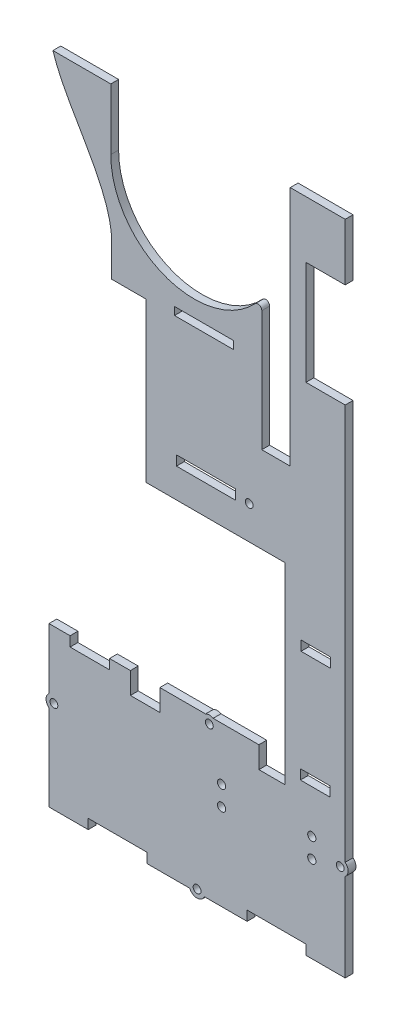
from build123d import *

# Parameters (mm, degrees)
SKETCH1_W           = 151
SKETCH1_H           = 254
BOSS_EXTRUDE1_DEPTH = 4
SKETCH2_W           = 49.486524855
SKETCH2_H           = 99.222786378
CUT_EXTRUDE1_DEPTH  = 5
SKETCH4_W           = 120.35
SKETCH4_H           = 88.04721362
CUT_EXTRUDE3_DEPTH  = 5
SKETCH6_R           = 2
CUT_EXTRUDE5_DEPTH  = 10
SKETCH12_W          = 15
SKETCH12_H          = 10
SKETCH12_W_2        = 13.35
CUT_EXTRUDE8_DEPTH  = 10
SKETCH13_R          = 2
CUT_EXTRUDE9_DEPTH  = 5
SKETCH14_R          = 4
SKETCH14_R_2        = 2
BOSS_EXTRUDE2_DEPTH = 4
SKETCH15_R          = 2.1
CUT_EXTRUDE10_DEPTH = 10
SKETCH18_R          = 2
CUT_EXTRUDE12_DEPTH = 5
SKETCH19_R          = 4
SKETCH19_R_2        = 2
BOSS_EXTRUDE3_DEPTH = 4
SKETCH25_W          = 59.513475145
SKETCH25_H          = 4
CUT_EXTRUDE16_DEPTH = 10
SKETCH26_W          = 151
SKETCH26_H          = 86
BOSS_EXTRUDE4_DEPTH = 4
SKETCH27_W          = 42
SKETCH27_H          = 62
BOSS_EXTRUDE5_DEPTH = 4
CUT_EXTRUDE17_DEPTH = 5
SKETCH29_W          = 20
SKETCH29_H          = 53
CUT_EXTRUDE18_DEPTH = 10
SKETCH30_W          = 14.513475145
SKETCH30_H          = 123
CUT_EXTRUDE19_DEPTH = 10
CUT_EXTRUDE20_DEPTH = 10
FILLET1_R           = 2
SKETCH33_W          = 30
SKETCH33_H          = 4
CUT_EXTRUDE22_DEPTH = 10
SKETCH34_W          = 30
SKETCH34_H          = 5
SKETCH34_W_2        = 15
CUT_EXTRUDE23_DEPTH = 10
SKETCH35_W          = 50.5
SKETCH35_H          = 0.999999998
SKETCH35_W_2        = 41.5
BOSS_EXTRUDE6_DEPTH = 4
SKETCH36_W          = 20.104648663
SKETCH36_H          = 5
CUT_EXTRUDE24_DEPTH = 5
SKETCH37_R          = 2
CUT_EXTRUDE25_DEPTH = 5
SKETCH38_R          = 4
SKETCH38_R_2        = 2
BOSS_EXTRUDE7_DEPTH = 4
SKETCH39_R          = 2
CUT_EXTRUDE26_DEPTH = 10


with BuildPart() as part:
    # Sketch1 → Boss-Extrude1 (new body)
    with BuildSketch(Plane.XY):
        with Locations((0, 0.5)):
            Rectangle(SKETCH1_W, SKETCH1_H)
    extrude(amount=BOSS_EXTRUDE1_DEPTH)

    # Sketch2 → Cut-Extrude1 (cut)
    with BuildSketch(Plane.XY.offset(4)):
        with Locations((-50.756737573, 77.888606811)):
            Rectangle(SKETCH2_W, SKETCH2_H)
    extrude(amount=-CUT_EXTRUDE1_DEPTH, mode=Mode.SUBTRACT)

    # Sketch4 → Cut-Extrude3 (cut)
    with BuildSketch(Plane.XY.offset(4)):
        with Locations((-15.325, -2.476393188)):
            Rectangle(SKETCH4_W, SKETCH4_H)
    extrude(amount=-CUT_EXTRUDE3_DEPTH, mode=Mode.SUBTRACT)

    # Sketch6 → Cut-Extrude5 (cut)
    with BuildSketch(Plane.XY.offset(4)):
        with Locations((0, -125)):
            Circle(SKETCH6_R)
    extrude(amount=-CUT_EXTRUDE5_DEPTH, mode=Mode.SUBTRACT)

    # Sketch12 → Cut-Extrude8 (cut)
    with BuildSketch(Plane.XY.offset(4)):
        with Locations((-26.5, -51.499999998)):
            Rectangle(SKETCH12_W, SKETCH12_H)
        with Locations((38.175, -51.499999998)):
            Rectangle(SKETCH12_W_2, SKETCH12_H)
    extrude(amount=-CUT_EXTRUDE8_DEPTH, mode=Mode.SUBTRACT)

    # Sketch13 → Cut-Extrude9 (cut)
    with BuildSketch(Plane.XY.offset(4)):
        with Locations((6.25, -49)):
            Circle(SKETCH13_R)
    extrude(amount=-CUT_EXTRUDE9_DEPTH, mode=Mode.SUBTRACT)

    # Sketch14 → Boss-Extrude2 (add)
    # profile 1 of 2: a face of its own
    with BuildSketch(Plane.XY.offset(4)):
        with Locations((6.25, -49)):
            Circle(SKETCH14_R)
        with Locations((6.25, -49)):
            Circle(SKETCH14_R_2, mode=Mode.SUBTRACT)
    # profile 2 of 2: a face of its own
    with BuildSketch(Plane.XY.offset(4)):
        with Locations((0, -125)):
            Circle(SKETCH14_R)
        with Locations((0, -125)):
            Circle(SKETCH14_R_2, mode=Mode.SUBTRACT)
    extrude(amount=-BOSS_EXTRUDE2_DEPTH)

    # Sketch15 → Cut-Extrude10 (cut)
    with BuildSketch(Plane(origin=(0, 0, 0), x_dir=(-1, 0, 0), z_dir=(0, 0, -1))):
        with Locations((-58.5, -72.5)):
            Circle(SKETCH15_R)
        with Locations((-58.5, -82.5)):
            Circle(SKETCH15_R)
        with Locations((-12.5, -72.5)):
            Circle(SKETCH15_R)
        with Locations((-12.5, -82.5)):
            Circle(SKETCH15_R)
    extrude(amount=-CUT_EXTRUDE10_DEPTH, mode=Mode.SUBTRACT)

    # Sketch18 → Cut-Extrude12 (cut)
    with BuildSketch(Plane.XY.offset(4)):
        with Locations((-73, -79.562158061)):
            Circle(SKETCH18_R)
    extrude(amount=-CUT_EXTRUDE12_DEPTH, mode=Mode.SUBTRACT)

    # Sketch19 → Boss-Extrude3 (add)
    with BuildSketch(Plane.XY.offset(4)):
        with Locations((-73, -79.562158061)):
            Circle(SKETCH19_R)
        with Locations((-73, -79.562158061)):
            Circle(SKETCH19_R_2, mode=Mode.SUBTRACT)
    extrude(amount=-BOSS_EXTRUDE3_DEPTH)

    # Sketch25 → Cut-Extrude16 (cut)
    with BuildSketch(Plane.XY.offset(4)):
        with Locations((3.743262427, 124.5)):
            Rectangle(SKETCH25_W, SKETCH25_H)
    extrude(amount=-CUT_EXTRUDE16_DEPTH, mode=Mode.SUBTRACT)

    # Sketch26 → Boss-Extrude4 (add)
    with BuildSketch(Plane.XY.offset(4)):
        with Locations((0, 165.5)):
            Rectangle(SKETCH26_W, SKETCH26_H)
    extrude(amount=-BOSS_EXTRUDE4_DEPTH)

    # Sketch27 → Boss-Extrude5 (add)
    with BuildSketch(Plane.XY.offset(4)):
        with Locations((54.5, 91.5)):
            Rectangle(SKETCH27_W, SKETCH27_H)
    extrude(amount=-BOSS_EXTRUDE5_DEPTH)

    # Sketch28 → Cut-Extrude17 (cut)
    with BuildSketch(Plane(origin=(0, 0, 0), x_dir=(-1, 0, 0), z_dir=(0, 0, -1))):
        with BuildLine():
            Line((43.55584756, 136.203397333), (43.55584756, 122.5))
            Line((43.55584756, 122.5), (75.5, 122.5))
            Line((75.5, 122.5), (75.5, 208.5))
            Line((75.5, 208.5), (73.5, 208.5))
            add(Edge.make_bspline(
                [(73.5, 208.5), (66.265840294, 185.251616354), (42.071208011, 161.186737721), (43.55584756, 136.203397333)],
                knots=[0, 0, 0, 0, 0.885856011, 0.885856011, 0.885856011, 0.885856011], degree=3))
        make_face()
    extrude(amount=-CUT_EXTRUDE17_DEPTH, mode=Mode.SUBTRACT)

    # Sketch29 → Cut-Extrude18 (cut)
    with BuildSketch(Plane(origin=(0, 0, 0), x_dir=(-1, 0, 0), z_dir=(0, 0, -1))):
        with Locations((-65.5, 153)):
            Rectangle(SKETCH29_W, SKETCH29_H)
    extrude(amount=-CUT_EXTRUDE18_DEPTH, mode=Mode.SUBTRACT)

    # Sketch30 → Cut-Extrude19 (cut)
    with BuildSketch(Plane.XY.offset(4)):
        with Locations((40.243262427, 147)):
            Rectangle(SKETCH30_W, SKETCH30_H)
    extrude(amount=-CUT_EXTRUDE19_DEPTH, mode=Mode.SUBTRACT)

    # Sketch31 → Cut-Extrude20 (cut)
    with BuildSketch(Plane.XY.offset(4)):
        with BuildLine():
            Line((-44, 177.3), (-44, 208.5))
            Line((-44, 208.5), (41, 208.5))
            Line((41, 208.5), (41, 177.3))
            ThreePointArc((41, 177.3), (-1.5, 134.8), (-44, 177.3))
        make_face()
    extrude(amount=-CUT_EXTRUDE20_DEPTH, mode=Mode.SUBTRACT)

    # Fillet1
    fillet1_edges = [part.edges().sort_by_distance(p)[0] for p in [
        (32.986524855, 152.461932373, 2),
    ]]
    fillet(fillet1_edges, radius=FILLET1_R)

    # Sketch33 → Cut-Extrude22 (cut)
    with BuildSketch(Plane.XY.offset(4)):
        with Locations((3.5, 124.5)):
            Rectangle(SKETCH33_W, SKETCH33_H)
    extrude(amount=-CUT_EXTRUDE22_DEPTH, mode=Mode.SUBTRACT)

    # Sketch34 → Cut-Extrude23 (cut)
    with BuildSketch(Plane.XY.offset(4)):
        with Locations((40.5, -124)):
            Rectangle(SKETCH34_W, SKETCH34_H)
        with Locations((-40.5, -124)):
            Rectangle(SKETCH34_W, SKETCH34_H)
        with Locations((60.175, -48)):
            Rectangle(SKETCH34_W_2, SKETCH34_H)
        with Locations((60.5, 9)):
            Rectangle(SKETCH34_W_2, SKETCH34_H)
        with Locations((4.5, 59)):
            Rectangle(SKETCH34_W, SKETCH34_H)
    extrude(amount=-CUT_EXTRUDE23_DEPTH, mode=Mode.SUBTRACT)

    # Sketch35 → Boss-Extrude6 (add)
    with BuildSketch(Plane.XY.offset(4)):
        with Locations((6.25, -45.999999999)):
            Rectangle(SKETCH35_W, SKETCH35_H)
        with Locations((-54.75, -45.999999999)):
            Rectangle(SKETCH35_W_2, SKETCH35_H)
    extrude(amount=-BOSS_EXTRUDE6_DEPTH)

    # Sketch36 → Cut-Extrude24 (cut)
    with BuildSketch(Plane.XY.offset(4)):
        with Locations((-54.697675668, -48)):
            Rectangle(SKETCH36_W, SKETCH36_H)
    extrude(amount=-CUT_EXTRUDE24_DEPTH, mode=Mode.SUBTRACT)

    # Sketch37 → Cut-Extrude25 (cut)
    with BuildSketch(Plane.XY.offset(4)):
        with Locations((73, -78.562158061)):
            Circle(SKETCH37_R)
    extrude(amount=-CUT_EXTRUDE25_DEPTH, mode=Mode.SUBTRACT)

    # Sketch38 → Boss-Extrude7 (add)
    with BuildSketch(Plane.XY.offset(4)):
        with Locations((73, -78.562158061)):
            Circle(SKETCH38_R)
        with Locations((73, -78.562158061)):
            Circle(SKETCH38_R_2, mode=Mode.SUBTRACT)
    extrude(amount=-BOSS_EXTRUDE7_DEPTH)

    # Sketch39 → Cut-Extrude26 (cut)
    with BuildSketch(Plane.XY.offset(4)):
        with Locations((26.57851787, 58.5)):
            Circle(SKETCH39_R)
    extrude(amount=-CUT_EXTRUDE26_DEPTH, mode=Mode.SUBTRACT)


solid = part.part
